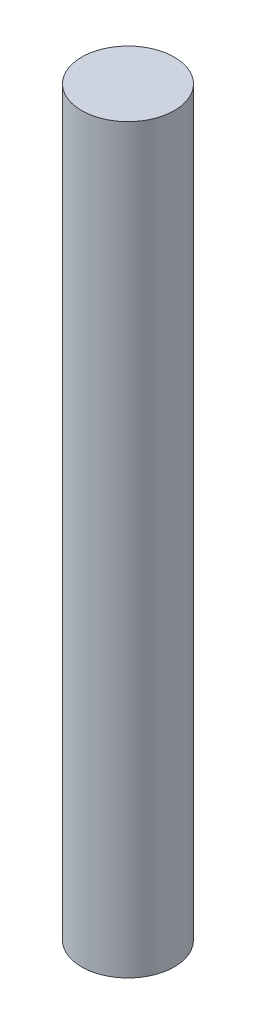
from build123d import *

# Parameters (mm, degrees)
SKETCH1_R           = 1
BOSS_EXTRUDE1_DEPTH = 16


with BuildPart() as part:
    # Sketch1 → Boss-Extrude1 (new body)
    with BuildSketch(Plane(origin=(0, 0, 0), x_dir=(1, 0, 0), z_dir=(0, 1, 0))):
        with Locations(Location((0, 0, 0), (0, 0, 270))):
            Circle(SKETCH1_R)
    extrude(amount=BOSS_EXTRUDE1_DEPTH)


solid = part.part
